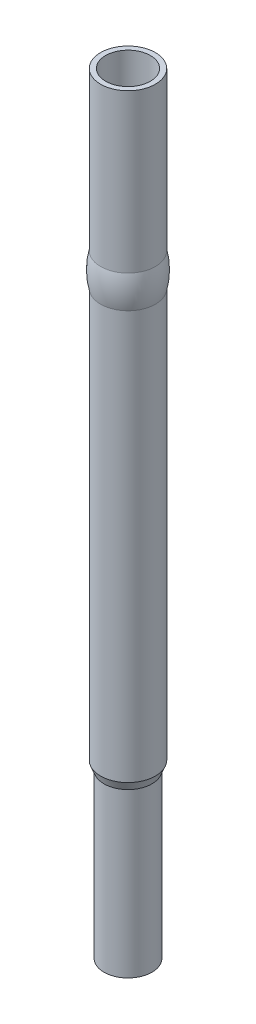
from build123d import *


with BuildPart() as part:
    # Sketch1 → Revolve1 (revolve)
    with BuildSketch(Plane(origin=(0, 0, 0), x_dir=(0, 0, -1), z_dir=(1, 0, 0)), mode=Mode.PRIVATE) as revolve1_sk:
        with BuildLine():
            Line((0.685, 0), (0.685, -14.48))
            Line((0.685, -14.48), (0, -14.48))
            Line((0, -14.48), (0, -18.62))
            Line((0, -18.62), (0.595, -18.62))
            Line((0.595, -18.62), (0.595, -23.62))
            Line((0.595, -23.62), (0.735, -23.62))
            Line((0.735, -23.62), (0.735, -18.62))
            Line((0.735, -18.62), (0.84, -18.36))
            Line((0.84, -18.36), (0.84, -5.84))
            ThreePointArc((0.84, -5.84), (0.9, -5.34), (0.84, -4.84))
            Line((0.84, -4.84), (0.84, 0))
            Line((0.84, 0), (0.685, 0))
        make_face()
    revolve(revolve1_sk.sketch.rotate(Axis((0, -14.48, 0), (0, -1, 0)), 180), axis=Axis((0, -14.48, 0), (0, -1, 0)))


solid = part.part
